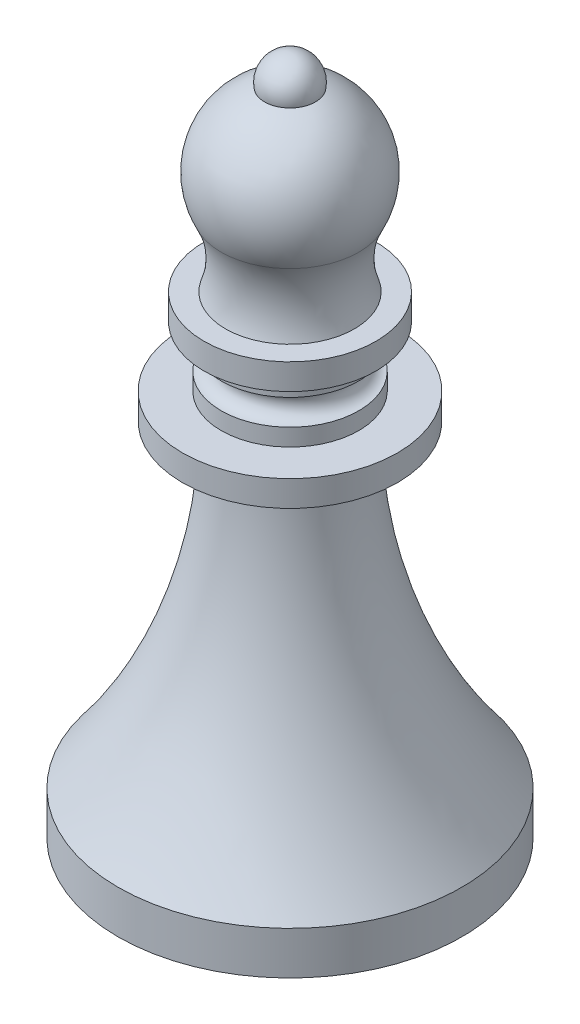
from build123d import *

# Parameters (mm, degrees)
FILLET1_R     = 2
SCALE_1_SCALE = 0.6


with BuildPart() as part:
    # Sketch1 → Revolve1 (revolve)
    with BuildSketch(Plane.XY, mode=Mode.PRIVATE) as revolve1_sk:
        with BuildLine():
            Line((0, -42), (0, 37.091148677))
            ThreePointArc((0, 37.091148677), (2.291287847, 36.02764035), (2.958039892, 33.591148677))
            ThreePointArc((2.958039892, 33.591148677), (8.355680086, 28.435189692), (8.005599308, 20.978925468))
            ThreePointArc((8.005599308, 20.978925468), (6.920726173, 17.042188603), (7.5, 13))
            Line((7.5, 13), (10, 13))
            Line((10, 13), (10, 10))
            Line((10, 10), (8, 10))
            Line((8, 10), (8, 8))
            ThreePointArc((8, 8), (6.5, 6.5), (8, 5))
            Line((8, 5), (8, 3))
            Line((8, 3), (12.5, 3))
            Line((12.5, 3), (12.5, 0))
            Line((12.5, 0), (7.5, 0))
            ThreePointArc((7.5, 0), (10.655312326, -19.545502593), (20, -37))
            Line((20, -37), (20, -42))
            Line((20, -42), (0, -42))
        make_face()
    revolve(revolve1_sk.sketch.rotate(Axis((0, 46.430278851, 0), (0, -1, 0)), 90), axis=Axis((0, 46.430278851, 0), (0, -1, 0)))

    # Fillet1
    fillet1_edges = [part.edges().sort_by_distance(p)[0] for p in [
        (0, 0, -7.5),
    ]]
    fillet(fillet1_edges, radius=FILLET1_R)


with BuildPart() as part_1:
    # 缩放比例1: scaled about (0, 0, 0)
    add(part.part.scale(SCALE_1_SCALE))


solid = part_1.part
